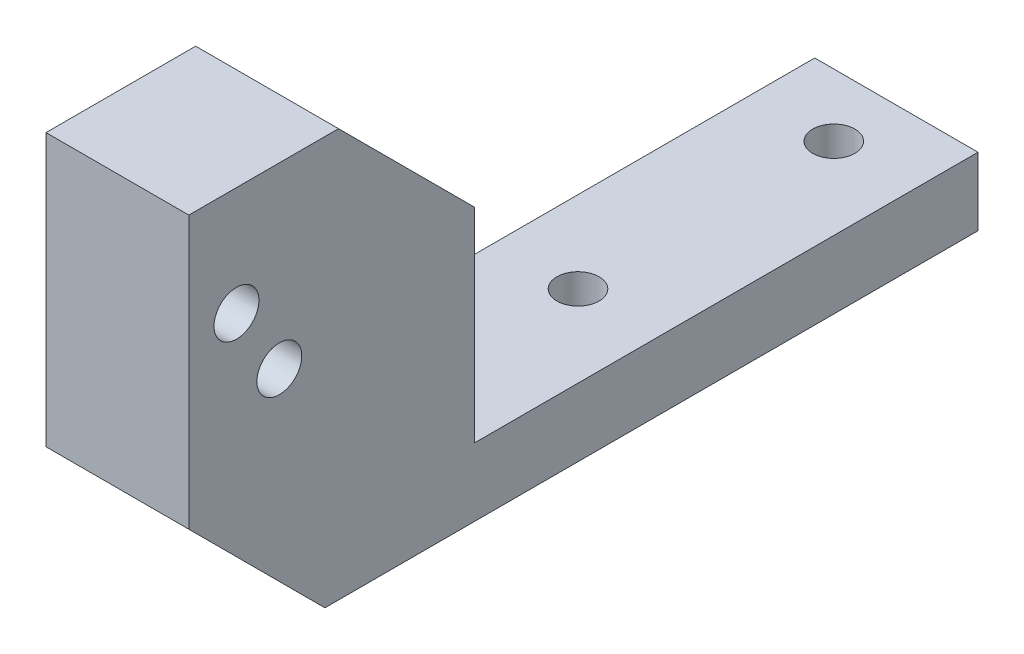
from build123d import *

# Parameters (mm, degrees)
SKETCH_1_W          = 12
SKETCH_1_H          = 28
SKETCH_1_R          = 1.55
EXTRUDE_1_DEPTH     = 2.5
SKETCH_2_W          = 12
SKETCH_2_H          = 5
EXTRUDE_2_DEPTH     = 30
SKETCH_3_W          = 10.5
SKETCH_3_H          = 21
EXTRUDE_3_DEPTH     = 25
CHAMFER_1_SIZE      = 10
SKETCH_4_R          = 1.65
CUT_EXTRUDE_1_DEPTH = 25
CHAMFER_2_SIZE      = 10


with BuildPart() as part:
    # 草图1 → 凸台-拉伸1 (new, symmetric)
    with BuildSketch(Plane(origin=(0, 0, 0), x_dir=(1, 0, 0), z_dir=(0, 1, 0))):
        Rectangle(SKETCH_1_W, SKETCH_1_H)
        with Locations(Location((0, 9.4, 0), (0, 0, 270))):
            Circle(SKETCH_1_R, mode=Mode.SUBTRACT)
        with Locations(Location((0, -9.4, 0), (0, 0, 90))):
            Circle(SKETCH_1_R, mode=Mode.SUBTRACT)
    extrude(amount=EXTRUDE_1_DEPTH, both=True)

    # 草图2 → 凸台-拉伸2 (add)
    with BuildSketch(Plane.XY.offset(14)):
        Rectangle(SKETCH_2_W, SKETCH_2_H)
    extrude(amount=EXTRUDE_2_DEPTH)

    # 草图3 → 凸台-拉伸3 (add)
    with BuildSketch(Plane(origin=(0, 2.5, 0), x_dir=(1, 0, 0), z_dir=(0, 1, 0))):
        with Locations((0.75, -33.5)):
            Rectangle(SKETCH_3_W, SKETCH_3_H)
    extrude(amount=EXTRUDE_3_DEPTH)

    # 倒角1
    chamfer_1_edges = [part.edges().sort_by_distance(p)[0] for p in [
        (0.75, 27.5, 23),
    ]]
    chamfer(chamfer_1_edges, length=CHAMFER_1_SIZE)

    # 草图4 → 切除-拉伸1 (cut)
    with BuildSketch(Plane.ZY.offset(4.5)):
        with Locations((40.5, 19.5)):
            Circle(SKETCH_4_R)
        with Locations((37.35, 14.393386641)):
            Circle(SKETCH_4_R)
    extrude(amount=-CUT_EXTRUDE_1_DEPTH, mode=Mode.SUBTRACT)

    # 倒角2
    chamfer_2_edges = [part.edges().sort_by_distance(p)[0] for p in [
        (0, -2.5, 44),
    ]]
    chamfer(chamfer_2_edges, length=CHAMFER_2_SIZE)


solid = part.part
